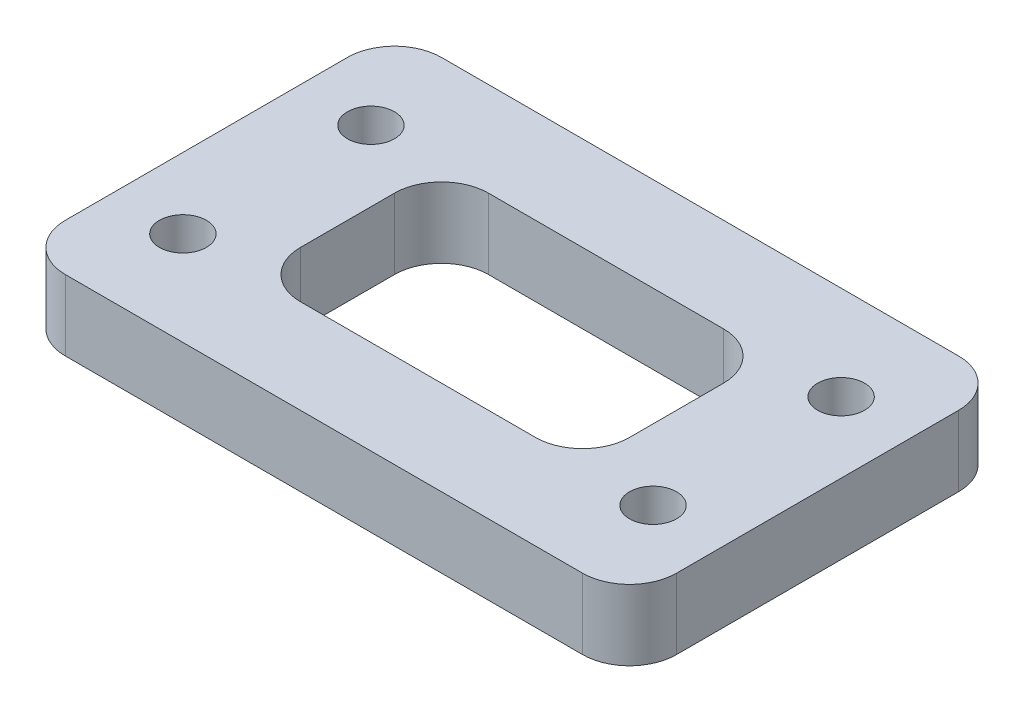
from build123d import *

# Parameters (mm, degrees)
SKETCH1_R           = 2.5
BOSS_EXTRUDE1_DEPTH = 7.5


with BuildPart() as part:
    # Sketch1 → Boss-Extrude1 (new body)
    with BuildSketch(Plane(origin=(0, 0, 0), x_dir=(1, 0, 0), z_dir=(0, 1, 0))):
        with BuildLine():
            Line((27.5, 20), (-27.5, 20))
            ThreePointArc((-27.5, 20), (-31.035533906, 18.535533906), (-32.5, 15))
            Line((-32.5, 15), (-32.5, -15))
            ThreePointArc((-32.5, -15), (-31.035533906, -18.535533906), (-27.5, -20))
            Line((-27.5, -20), (27.5, -20))
            ThreePointArc((27.5, -20), (31.035533906, -18.535533906), (32.5, -15))
            Line((32.5, -15), (32.5, 15))
            ThreePointArc((32.5, 15), (31.035533906, 18.535533906), (27.5, 20))
        make_face()
        with Locations(Location((-25, 10, 0), (0, 0, 270))):
            Circle(SKETCH1_R, mode=Mode.SUBTRACT)
        with Locations(Location((25, 10, 0), (0, 0, 270))):
            Circle(SKETCH1_R, mode=Mode.SUBTRACT)
        with Locations(Location((25, -10, 0), (0, 0, 90))):
            Circle(SKETCH1_R, mode=Mode.SUBTRACT)
        with Locations(Location((-25, -10, 0), (0, 0, 90))):
            Circle(SKETCH1_R, mode=Mode.SUBTRACT)
        with BuildLine():
            Line((12.5, 10), (-12.5, 10))
            ThreePointArc((-12.5, 10), (-16.035533906, 8.535533906), (-17.5, 5))
            Line((-17.5, 5), (-17.5, -5))
            ThreePointArc((-17.5, -5), (-16.035533906, -8.535533906), (-12.5, -10))
            Line((-12.5, -10), (12.5, -10))
            ThreePointArc((12.5, -10), (16.035533906, -8.535533906), (17.5, -5))
            Line((17.5, -5), (17.5, 5))
            ThreePointArc((17.5, 5), (16.035533906, 8.535533906), (12.5, 10))
        make_face(mode=Mode.SUBTRACT)
    extrude(amount=BOSS_EXTRUDE1_DEPTH)


solid = part.part
